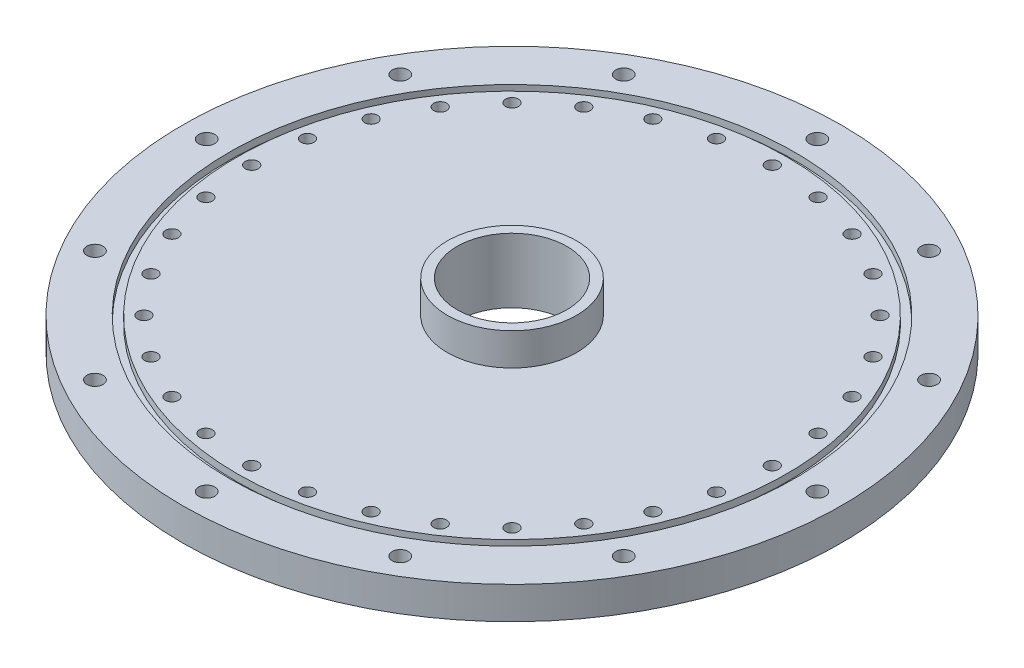
from build123d import *

# Parameters (mm, degrees)
SKETCH1_R                  = 129.54
SKETCH1_R_2                = 21.59
SKETCH1_R_3                = 3.175
BOSS_EXTRUDE1_DEPTH        = 12.7
SKETCH2_R                  = 111.125
SKETCH2_R_2                = 107.95
CUT_EXTRUDE1_DEPTH         = 2.794
F_1_4_0_2_DIAMETER_HOLE1_D = 5.08
SKETCH5_R                  = 25.4
SKETCH5_R_2                = 21.59
BOSS_EXTRUDE2_DEPTH        = 12.7


with BuildPart() as part:
    # Sketch1 → Boss-Extrude1 (new body)
    with BuildSketch(Plane(origin=(0, 0, 0), x_dir=(1, 0, 0), z_dir=(0, 1, 0))):
        with Locations(Location((0, 0, 0), (0, 0, 270))):
            Circle(SKETCH1_R)
        with Locations(Location((0, 0, 0), (0, 0, 270))):
            Circle(SKETCH1_R_2, mode=Mode.SUBTRACT)
        with Locations(Location((0, 120.015, 0), (0, 0, 270))):
            Circle(SKETCH1_R_3, mode=Mode.SUBTRACT)
        with Locations(Location((60.0075, 103.936038835, 0), (0, 0, 270))):
            Circle(SKETCH1_R_3, mode=Mode.SUBTRACT)
        with Locations(Location((103.936038835, 60.0075, 0), (0, 0, 270))):
            Circle(SKETCH1_R_3, mode=Mode.SUBTRACT)
        with Locations(Location((120.015, 0, 0), (0, 0, 270))):
            Circle(SKETCH1_R_3, mode=Mode.SUBTRACT)
        with Locations(Location((103.936038835, -60.0075, 0), (0, 0, 270))):
            Circle(SKETCH1_R_3, mode=Mode.SUBTRACT)
        with Locations(Location((60.0075, -103.936038835, 0), (0, 0, 270))):
            Circle(SKETCH1_R_3, mode=Mode.SUBTRACT)
        with Locations(Location((0, -120.015, 0), (0, 0, 270))):
            Circle(SKETCH1_R_3, mode=Mode.SUBTRACT)
        with Locations(Location((-60.0075, -103.936038835, 0), (0, 0, 270))):
            Circle(SKETCH1_R_3, mode=Mode.SUBTRACT)
        with Locations(Location((-103.936038835, -60.0075, 0), (0, 0, 270))):
            Circle(SKETCH1_R_3, mode=Mode.SUBTRACT)
        with Locations(Location((-120.015, 0, 0), (0, 0, 270))):
            Circle(SKETCH1_R_3, mode=Mode.SUBTRACT)
        with Locations(Location((-103.936038835, 60.0075, 0), (0, 0, 270))):
            Circle(SKETCH1_R_3, mode=Mode.SUBTRACT)
        with Locations(Location((-60.0075, 103.936038835, 0), (0, 0, 270))):
            Circle(SKETCH1_R_3, mode=Mode.SUBTRACT)
    extrude(amount=BOSS_EXTRUDE1_DEPTH)

    # Sketch2 → Cut-Extrude1 (cut)
    with BuildSketch(Plane(origin=(0, 12.7, 0), x_dir=(1, 0, 0), z_dir=(0, 1, 0))):
        with Locations(Location((0, 0, 0), (0, 0, 270))):
            Circle(SKETCH2_R)
        with Locations(Location((0, 0, 0), (0, 0, 270))):
            Circle(SKETCH2_R_2, mode=Mode.SUBTRACT)
    extrude(amount=-CUT_EXTRUDE1_DEPTH, mode=Mode.SUBTRACT)

    # 1/4 (0.2) Diameter Hole1 (through all)
    with Locations(Plane(origin=(19.959924954, 12.7, -100.34531898), x_dir=(0, 0, 1), z_dir=(0, 1, 0))):
        with Locations((0, 0), (5.822095353, 19.192876231), (15.276665182, 36.881132271), (28.000375669, 52.385018357), (43.504261755, 65.108728844), (61.192517795, 74.563298673), (80.385394026, 80.385394026), (100.34531898, 82.351275046), (120.305243934, 80.385394026), (139.498120165, 74.563298673), (157.186376204, 65.108728844), (172.690262291, 52.385018357), (185.413972778, 36.881132271), (194.868542607, 19.192876231), (200.69063796, 0), (202.65651898, -19.959924954), (200.69063796, -39.919849908), (194.868542607, -59.112726139), (185.413972778, -76.800982178), (172.690262291, -92.304868265), (157.186376205, -105.028578752), (139.498120165, -114.483148581), (120.305243934, -120.305243934), (100.34531898, -122.271124954), (80.385394026, -120.305243934), (61.192517795, -114.483148581), (43.504261756, -105.028578752), (28.000375669, -92.304868265), (15.276665182, -76.800982179), (5.822095353, -59.112726139), (0, -39.919849908), (-1.96588102, -19.959924954)):
            Hole(F_1_4_0_2_DIAMETER_HOLE1_D / 2)

    # Sketch5 → Boss-Extrude2 (add)
    with BuildSketch(Plane(origin=(0, 12.7, 0), x_dir=(1, 0, 0), z_dir=(0, 1, 0))):
        with Locations(Location((0, 0, 0), (0, 0, 270))):
            Circle(SKETCH5_R)
        with Locations(Location((0, 0, 0), (0, 0, 270))):
            Circle(SKETCH5_R_2, mode=Mode.SUBTRACT)
    extrude(amount=BOSS_EXTRUDE2_DEPTH)


solid = part.part
